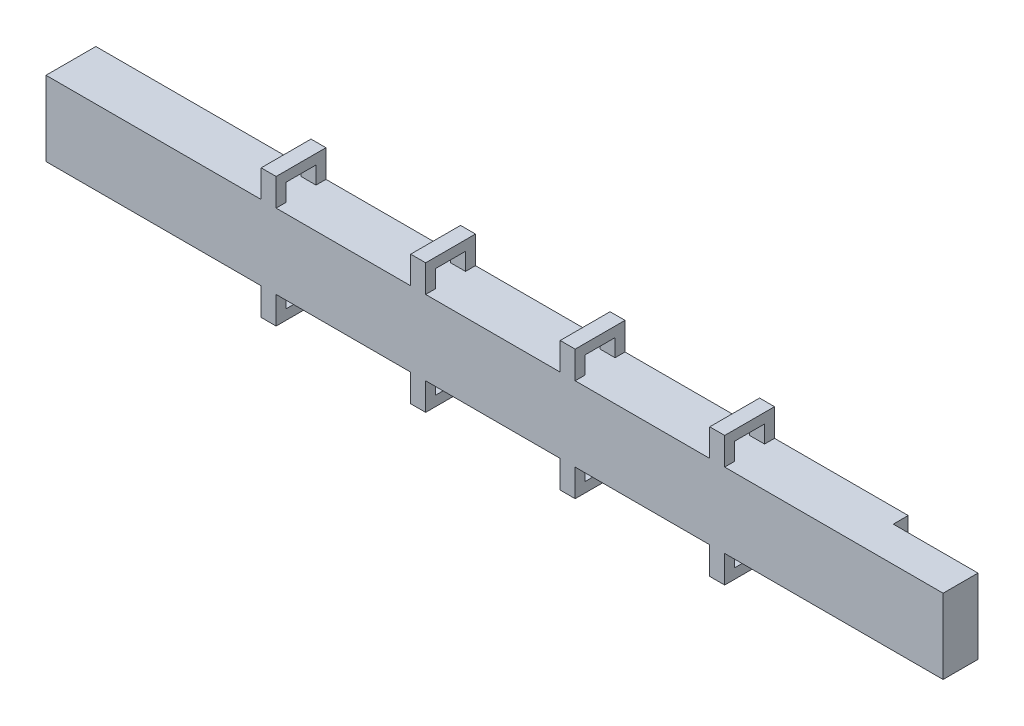
from build123d import *

# Parameters (mm, degrees)
SKETCH1_W               = 180
SKETCH1_H               = 10
BOSS_EXTRUDE1_DEPTH     = 15
SKETCH2_W               = 17
SKETCH2_H               = 15
CUT_EXTRUDE1_DEPTH      = 3
SKETCH3_W               = 3
SKETCH3_H               = 10
BOSS_EXTRUDE2_DEPTH     = 5.5
SKETCH4_W               = 6
SKETCH4_H               = 3.5
CUT_EXTRUDE2_DEPTH      = 7
LPATTERN1_COUNT         = 4
LPATTERN1_PITCH         = 30
MIRROR1_COPY_1_SKETCH_W = 3
MIRROR1_COPY_1_SKETCH_H = 10
MIRROR1_COPY_1_DEPTH    = 5.5
MIRROR1_COPY_2_SKETCH_W = 3
MIRROR1_COPY_2_SKETCH_H = 10
MIRROR1_COPY_2_DEPTH    = 5.5
MIRROR1_COPY_3_SKETCH_W = 3
MIRROR1_COPY_3_SKETCH_H = 10
MIRROR1_COPY_3_DEPTH    = 5.5
MIRROR1_COPY_4_SKETCH_W = 6
MIRROR1_COPY_4_SKETCH_H = 3.5
MIRROR1_COPY_4_DEPTH    = 7
MIRROR1_COPY_5_SKETCH_W = 6
MIRROR1_COPY_5_SKETCH_H = 3.5
MIRROR1_COPY_5_DEPTH    = 7
MIRROR1_COPY_6_SKETCH_W = 6
MIRROR1_COPY_6_SKETCH_H = 3.5
MIRROR1_COPY_6_DEPTH    = 7


with BuildPart() as part:
    # Sketch1 → Boss-Extrude1 (new body)
    with BuildSketch(Plane(origin=(0, 0, 0), x_dir=(1, 0, 0), z_dir=(0, 1, 0))):
        Rectangle(SKETCH1_W, SKETCH1_H)
    extrude(amount=BOSS_EXTRUDE1_DEPTH)

    # Sketch2 → Cut-Extrude1 (cut)
    with BuildSketch(Plane(origin=(0, 0, -5), x_dir=(-1, 0, 0), z_dir=(0, 0, -1))):
        with Locations((-81.5, 7.5)):
            Rectangle(SKETCH2_W, SKETCH2_H)
    extrude(amount=-CUT_EXTRUDE1_DEPTH, mode=Mode.SUBTRACT)

    # Sketch3 → Boss-Extrude2 (add)
    with BuildSketch(Plane(origin=(0, 15, 0), x_dir=(1, 0, 0), z_dir=(0, 1, 0))):
        with Locations((44.673610622, 0)):
            Rectangle(SKETCH3_W, SKETCH3_H)
    boss_extrude2 = extrude(amount=BOSS_EXTRUDE2_DEPTH)

    # Sketch4 → Cut-Extrude2 (cut)
    with BuildSketch(Plane(origin=(46.173610622, 0, 0), x_dir=(0, 0, -1), z_dir=(1, 0, 0))):
        with Locations((0, 16.75)):
            Rectangle(SKETCH4_W, SKETCH4_H)
    cut_extrude2 = extrude(amount=-CUT_EXTRUDE2_DEPTH, mode=Mode.SUBTRACT)

    # LPattern1: Boss-Extrude2, Cut-Extrude2 ×4
    with Locations(*[(-i * LPATTERN1_PITCH, 0, 0) for i in range(1, LPATTERN1_COUNT)]):
        add(boss_extrude2)
        add(cut_extrude2, mode=Mode.SUBTRACT)

    # Mirror1: Boss-Extrude2, Cut-Extrude2 across plane
    add(boss_extrude2.mirror(Plane(origin=(0, 7.5, 0), x_dir=(0, 0, 1), z_dir=(0, -1, 0))))
    add(cut_extrude2.mirror(Plane(origin=(0, 7.5, 0), x_dir=(0, 0, 1), z_dir=(0, -1, 0))), mode=Mode.SUBTRACT)

    # Mirror1 copy 1 sketch → Mirror1 copy 1 (add)
    with BuildSketch(Plane(origin=(-30, 0, 0), x_dir=(1, 0, 0), z_dir=(0, -1, 0))):
        with Locations((44.673610622, 0)):
            Rectangle(MIRROR1_COPY_1_SKETCH_W, MIRROR1_COPY_1_SKETCH_H)
    extrude(amount=MIRROR1_COPY_1_DEPTH)

    # Mirror1 copy 2 sketch → Mirror1 copy 2 (add)
    with BuildSketch(Plane(origin=(-60, 0, 0), x_dir=(1, 0, 0), z_dir=(0, -1, 0))):
        with Locations((44.673610622, 0)):
            Rectangle(MIRROR1_COPY_2_SKETCH_W, MIRROR1_COPY_2_SKETCH_H)
    extrude(amount=MIRROR1_COPY_2_DEPTH)

    # Mirror1 copy 3 sketch → Mirror1 copy 3 (add)
    with BuildSketch(Plane(origin=(-90, 0, 0), x_dir=(1, 0, 0), z_dir=(0, -1, 0))):
        with Locations((44.673610622, 0)):
            Rectangle(MIRROR1_COPY_3_SKETCH_W, MIRROR1_COPY_3_SKETCH_H)
    extrude(amount=MIRROR1_COPY_3_DEPTH)

    # Mirror1 copy 4 sketch → Mirror1 copy 4 (cut)
    with BuildSketch(Plane(origin=(16.173610622, 15, 0), x_dir=(0, 0, -1), z_dir=(1, 0, 0))):
        with Locations((0, -16.75)):
            Rectangle(MIRROR1_COPY_4_SKETCH_W, MIRROR1_COPY_4_SKETCH_H)
    extrude(amount=-MIRROR1_COPY_4_DEPTH, mode=Mode.SUBTRACT)

    # Mirror1 copy 5 sketch → Mirror1 copy 5 (cut)
    with BuildSketch(Plane(origin=(-13.826389378, 15, 0), x_dir=(0, 0, -1), z_dir=(1, 0, 0))):
        with Locations((0, -16.75)):
            Rectangle(MIRROR1_COPY_5_SKETCH_W, MIRROR1_COPY_5_SKETCH_H)
    extrude(amount=-MIRROR1_COPY_5_DEPTH, mode=Mode.SUBTRACT)

    # Mirror1 copy 6 sketch → Mirror1 copy 6 (cut)
    with BuildSketch(Plane(origin=(-43.826389378, 15, 0), x_dir=(0, 0, -1), z_dir=(1, 0, 0))):
        with Locations((0, -16.75)):
            Rectangle(MIRROR1_COPY_6_SKETCH_W, MIRROR1_COPY_6_SKETCH_H)
    extrude(amount=-MIRROR1_COPY_6_DEPTH, mode=Mode.SUBTRACT)


solid = part.part
